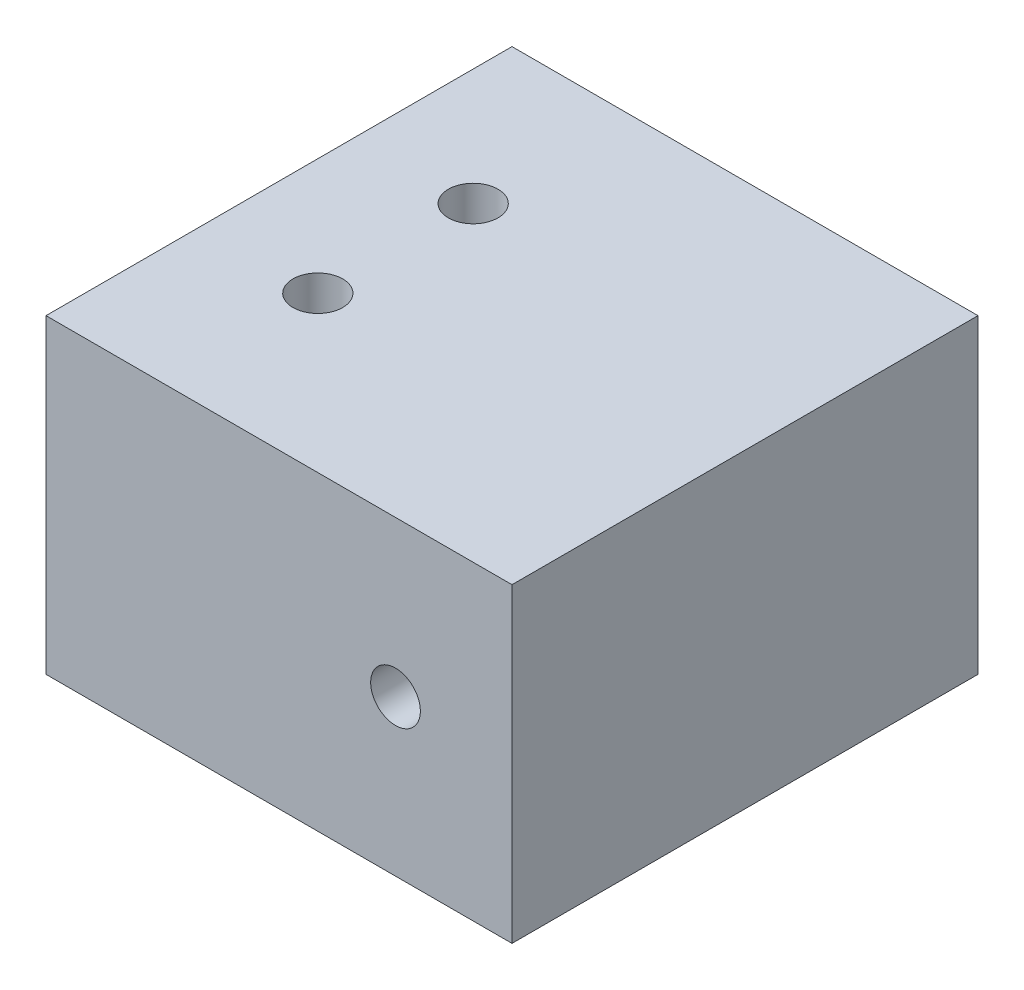
from build123d import *

# Parameters (mm, degrees)
SKETCH_1_W          = 30
SKETCH_1_H          = 30
SKETCH_1_R          = 1.6
EXTRUDE_1_DEPTH     = 20
SKETCH_2_R          = 1.6
CUT_EXTRUDE_1_DEPTH = 47.904157598


with BuildPart() as part:
    # 草图1 → 凸台-拉伸1 (new body)
    with BuildSketch(Plane(origin=(0, 0, 0), x_dir=(1, 0, 0), z_dir=(0, 1, 0))):
        with Locations((15, 15)):
            Rectangle(SKETCH_1_W, SKETCH_1_H)
        with Locations(Location((7.5, 20, 0), (0, 0, 270))):
            Circle(SKETCH_1_R, mode=Mode.SUBTRACT)
        with Locations(Location((7.5, 10, 0), (0, 0, 270))):
            Circle(SKETCH_1_R, mode=Mode.SUBTRACT)
    extrude(amount=EXTRUDE_1_DEPTH)

    # 草图2 → 切除-拉伸1 (cut, through all)
    with BuildSketch(Plane(origin=(0, 0, -30), x_dir=(-1, 0, 0), z_dir=(0, 0, -1))):
        with Locations((-22.5, 10)):
            Circle(SKETCH_2_R)
    extrude(amount=-CUT_EXTRUDE_1_DEPTH, mode=Mode.SUBTRACT)


solid = part.part
